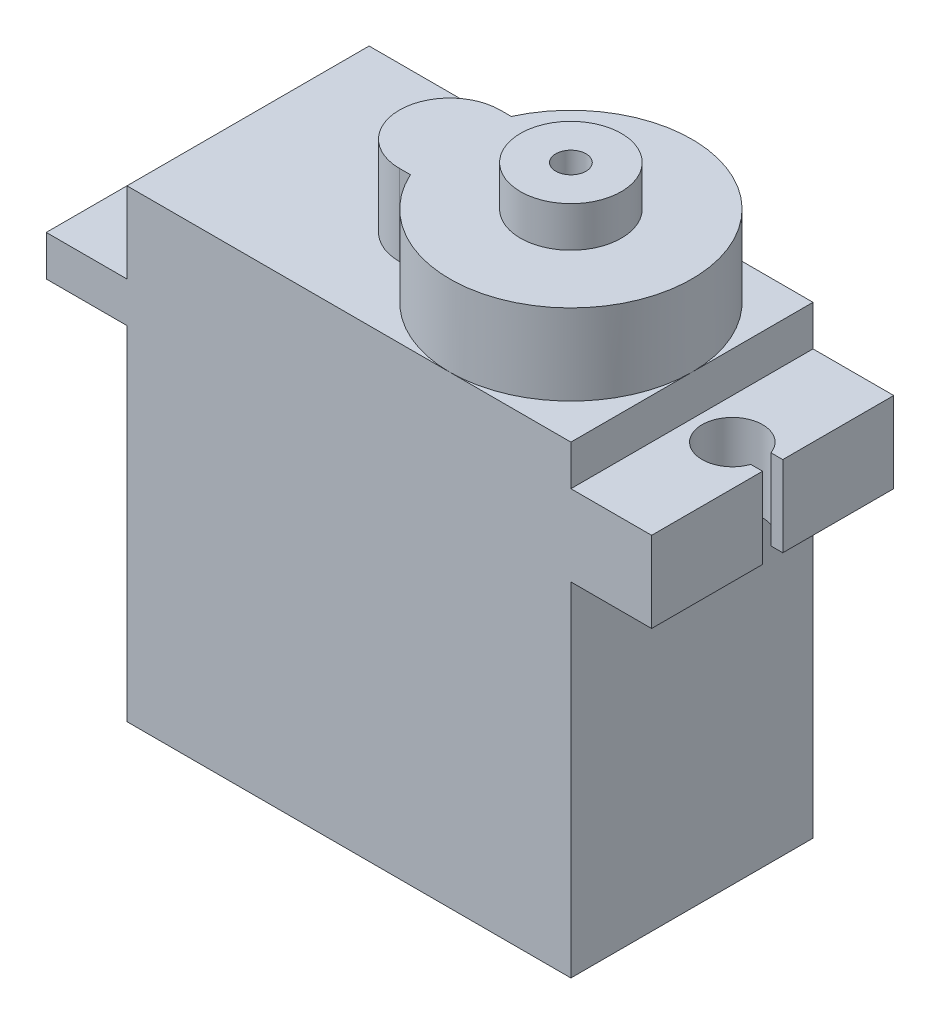
from build123d import *

# Parameters (mm, degrees)
CROQUIS1_W              = 22
CROQUIS1_H              = 23
SALIENTE_EXTRUIR1_DEPTH = 12
CROQUIS2_W              = 12
CROQUIS2_H              = 2
SALIENTE_EXTRUIR2_DEPTH = 5
CORTAR_EXTRUIR2_DEPTH   = 2
CROQUIS13_W             = 12
CROQUIS13_H             = 2
SALIENTE_EXTRUIR3_DEPTH = 4
CORTAR_EXTRUIR3_DEPTH   = 2
SALIENTE_EXTRUIR4_DEPTH = 4
CROQUIS16_R             = 2.5
SALIENTE_EXTRUIR5_DEPTH = 6
CROQUIS21_R             = 0.75
CORTAR_EXTRUIR6_DEPTH   = 2


with BuildPart() as part:
    # Croquis1 → Saliente-Extruir1 (new body)
    with BuildSketch(Plane.XY):
        with Locations((-25.140327955, -0.424857882)):
            Rectangle(CROQUIS1_W, CROQUIS1_H)
    extrude(amount=SALIENTE_EXTRUIR1_DEPTH)

    # Croquis2 → Saliente-Extruir2 (add)
    with BuildSketch(Plane(origin=(-14.140327955, 0, 0), x_dir=(0, 0, -1), z_dir=(1, 0, 0))):
        with Locations((-6, 6.075142118)):
            Rectangle(CROQUIS2_W, CROQUIS2_H)
    saliente_extruir2 = extrude(amount=SALIENTE_EXTRUIR2_DEPTH)

    # Croquis3 → Cortar-Extruir2 (cut)
    with BuildSketch(Plane(origin=(0, 7.075142118, 0), x_dir=(1, 0, 0), z_dir=(0, 1, 0))):
        with BuildLine():
            Line((-10.140327955, -5.5), (-10.726114393, -5.5))
            ThreePointArc((-10.726114393, -5.5), (-13.640327955, -6), (-10.726114393, -6.5))
            Line((-10.726114393, -6.5), (-10.140327955, -6.5))
            Line((-10.140327955, -6.5), (-10.140327955, -12))
            Line((-10.140327955, -12), (-9.140327955, -12))
            Line((-9.140327955, -12), (-9.140327955, 0))
            Line((-9.140327955, 0), (-10.140327955, 0))
            Line((-10.140327955, 0), (-10.140327955, -5.5))
        make_face()
    cortar_extruir2 = extrude(amount=-CORTAR_EXTRUIR2_DEPTH, mode=Mode.SUBTRACT)

    # Simetría1: Saliente-Extruir2, Cortar-Extruir2 across plane
    add(saliente_extruir2.mirror(Plane(origin=(-9.140327955, 7.075142118, 12), x_dir=(0, 0, 1), z_dir=(0, -1, 0))))
    add(cortar_extruir2.mirror(Plane(origin=(-9.140327955, 7.075142118, 12), x_dir=(0, 0, 1), z_dir=(0, -1, 0))), mode=Mode.SUBTRACT)

    # Croquis13 → Saliente-Extruir3 (add)
    with BuildSketch(Plane.ZY.offset(36.140327955)):
        with Locations((6, 6.075142118)):
            Rectangle(CROQUIS13_W, CROQUIS13_H)
    extrude(amount=SALIENTE_EXTRUIR3_DEPTH)

    # Croquis14 → Cortar-Extruir3 (cut)
    with BuildSketch(Plane(origin=(0, 7.075142118, 0), x_dir=(1, 0, 0), z_dir=(0, 1, 0))):
        with BuildLine():
            Line((-40.140327955, -6.5), (-40.140327955, -5.5))
            Line((-40.140327955, -5.5), (-39.554541518, -5.5))
            ThreePointArc((-39.554541518, -5.5), (-36.640327955, -6), (-39.554541518, -6.5))
            Line((-39.554541518, -6.5), (-40.140327955, -6.5))
        make_face()
    extrude(amount=-CORTAR_EXTRUIR3_DEPTH, mode=Mode.SUBTRACT)

    # Croquis15 → Saliente-Extruir4 (add)
    with BuildSketch(Plane(origin=(0, 11.075142118, 0), x_dir=(1, 0, 0), z_dir=(0, 1, 0))):
        with BuildLine():
            ThreePointArc((-25.594684013, -3.5), (-14.140327955, -6), (-25.594684013, -8.5))
            Line((-25.594684013, -8.5), (-26.140327955, -8.5))
            ThreePointArc((-26.140327955, -8.5), (-28.640327955, -6), (-26.140327955, -3.5))
            Line((-26.140327955, -3.5), (-25.594684013, -3.5))
        make_face()
    extrude(amount=SALIENTE_EXTRUIR4_DEPTH)

    # Croquis16 → Saliente-Extruir5 (add)
    with BuildSketch(Plane(origin=(0, 11.075142118, 0), x_dir=(1, 0, 0), z_dir=(0, 1, 0))):
        with Locations(Location((-20.140327955, -6, 0), (0, 0, 270))):
            Circle(CROQUIS16_R)
    extrude(amount=SALIENTE_EXTRUIR5_DEPTH)

    # Croquis21 → Cortar-Extruir6 (cut)
    with BuildSketch(Plane(origin=(0, 17.075142118, 0), x_dir=(1, 0, 0), z_dir=(0, 1, 0))):
        with Locations(Location((-20.140327955, -6, 0), (0, 0, 270))):
            Circle(CROQUIS21_R)
    extrude(amount=-CORTAR_EXTRUIR6_DEPTH, mode=Mode.SUBTRACT)


solid = part.part
